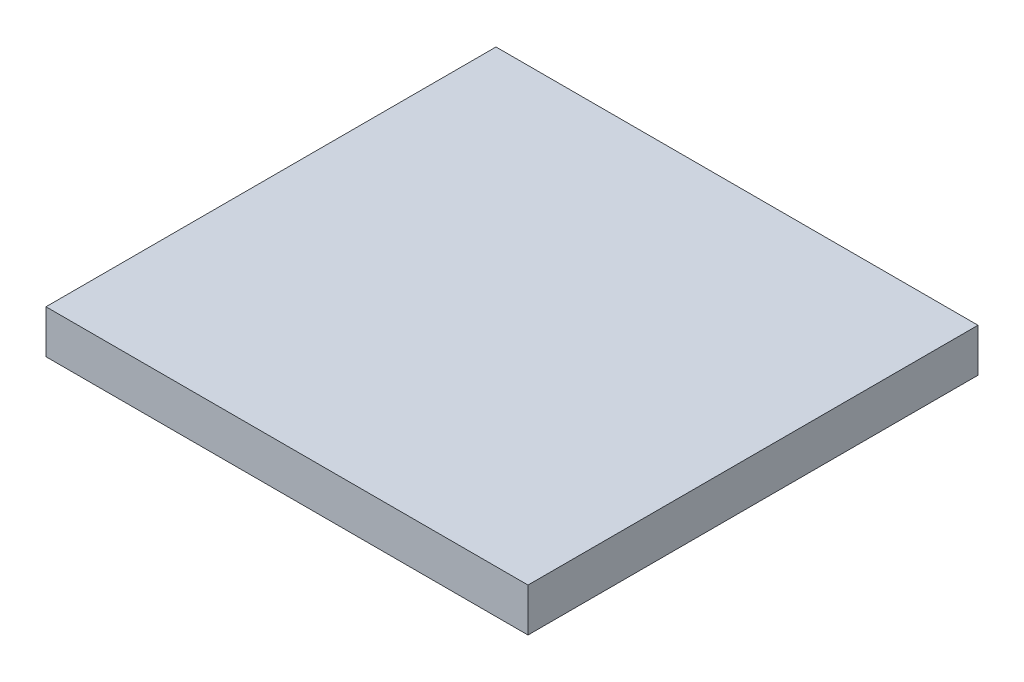
from build123d import *

# Parameters (mm, degrees)
SKETCH1_W           = 203.2
SKETCH1_H           = 189.70625
BOSS_EXTRUDE1_DEPTH = 18.25625


with BuildPart() as part:
    # Sketch1 → Boss-Extrude1 (new body)
    with BuildSketch(Plane(origin=(0, 0, 0), x_dir=(1, 0, 0), z_dir=(0, 1, 0))):
        with Locations((47.786265385, -29.022731199)):
            Rectangle(SKETCH1_W, SKETCH1_H)
    extrude(amount=BOSS_EXTRUDE1_DEPTH)


solid = part.part
